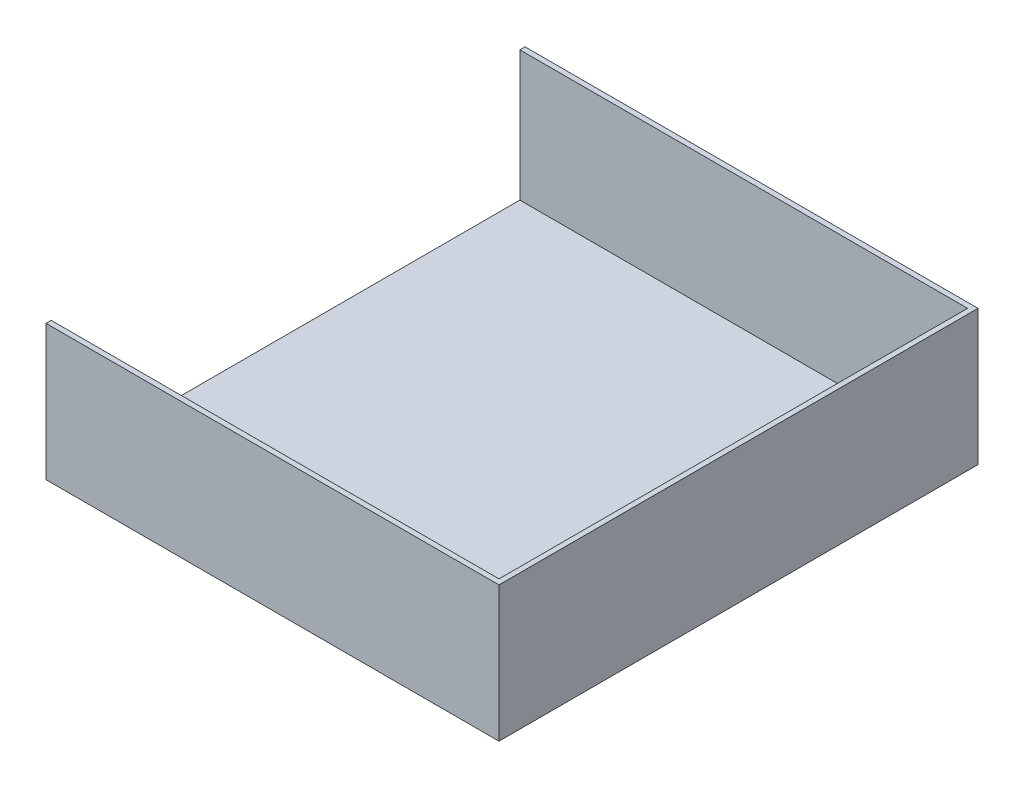
from build123d import *

# Parameters (mm, degrees)
SKETCH1_W           = 279.4
SKETCH1_H           = 292.1
BOSS_EXTRUDE1_DEPTH = 82.55
SKETCH3_W           = 273.05
SKETCH3_H           = 285.75
CUT_EXTRUDE1_DEPTH  = 79.375
CUT_EXTRUDE2_REACH  = 414.555
SKETCH4_W           = 3.175
SKETCH4_H           = 292.1


with BuildPart() as part:
    # Sketch1 → Boss-Extrude1 (new body)
    with BuildSketch(Plane(origin=(0, 0, 0), x_dir=(1, 0, 0), z_dir=(0, 1, 0))):
        with Locations((139.7, 146.05)):
            Rectangle(SKETCH1_W, SKETCH1_H)
    extrude(amount=BOSS_EXTRUDE1_DEPTH)

    # Sketch3 → Cut-Extrude1 (cut)
    with BuildSketch(Plane(origin=(0, 82.55, 0), x_dir=(1, 0, 0), z_dir=(0, 1, 0))):
        with Locations((139.7, 146.05)):
            Rectangle(SKETCH3_W, SKETCH3_H)
    extrude(amount=-CUT_EXTRUDE1_DEPTH, mode=Mode.SUBTRACT)

    # Sketch4 → Cut-Extrude2 (cut, up to next)
    with BuildSketch(Plane(origin=(0, 82.55, 0), x_dir=(1, 0, 0), z_dir=(0, 1, 0)), mode=Mode.PRIVATE) as cut_extrude2_sk1:
        with Locations((1.5875, 146.05)):
            Rectangle(SKETCH4_W, SKETCH4_H)
    cut_extrude2_tool1 = extrude(cut_extrude2_sk1.sketch, amount=-CUT_EXTRUDE2_REACH, mode=Mode.PRIVATE) & part.part
    add(cut_extrude2_tool1.solids().sort_by_distance((1.5875, 82.55, -146.05))[0], mode=Mode.SUBTRACT)


solid = part.part
